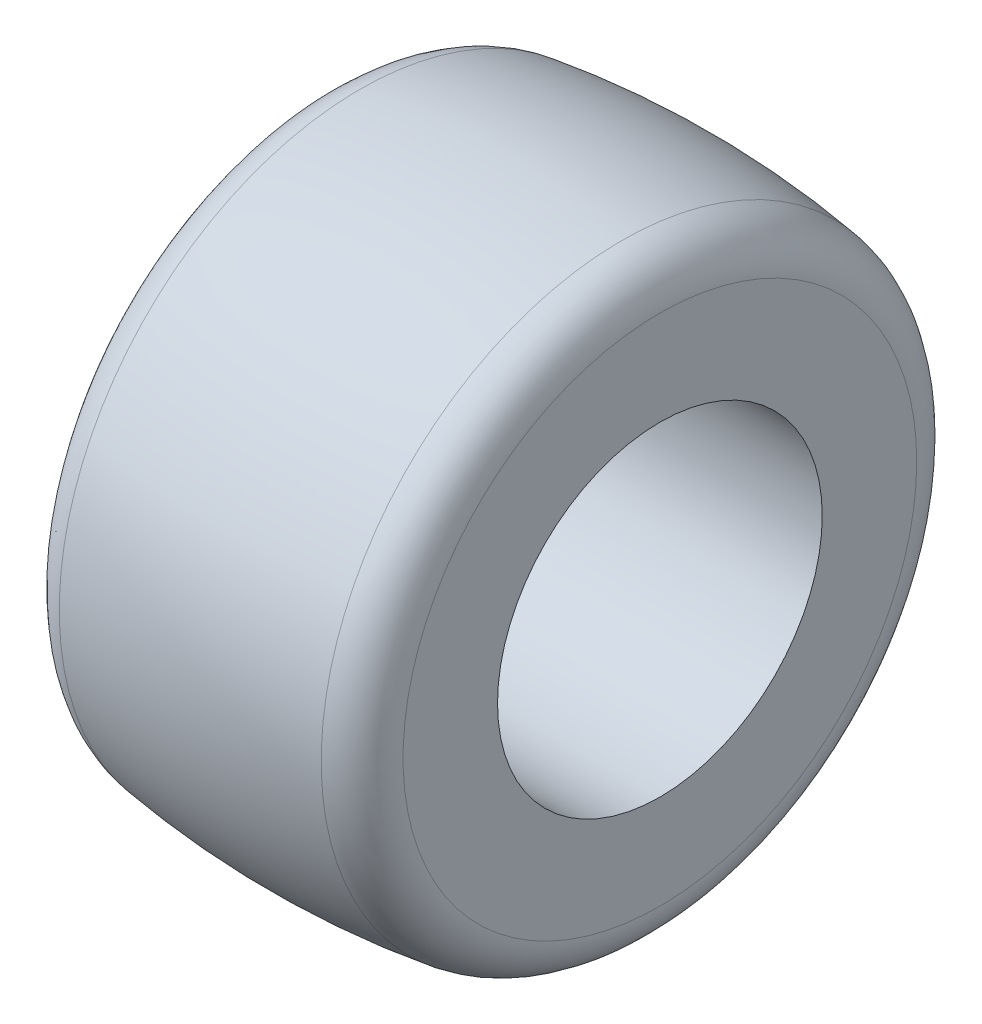
from build123d import *

# Parameters (mm, degrees)
SKETCH2_R          = 11
CUT_EXTRUDE1_DEPTH = 38.502133385


with BuildPart() as part:
    # Sketch1 → Revolve1 (revolve)
    with BuildSketch(Plane.XY, mode=Mode.PRIVATE) as revolve1_sk:
        with BuildLine():
            Line((0, 0), (0, 17.401543363))
            ThreePointArc((0, 17.401543363), (0.734116466, 19.367699972), (2.577181208, 20.371597953))
            ThreePointArc((2.577181208, 20.371597953), (11.45, 21), (20.322818792, 20.371597953))
            ThreePointArc((20.322818792, 20.371597953), (22.165883534, 19.367699972), (22.9, 17.401543363))
            Line((22.9, 17.401543363), (22.9, 0))
            Line((22.9, 0), (0, 0))
        make_face()
    revolve(revolve1_sk.sketch.rotate(Axis((22.9, 0, 0), (-1, 0, 0)), 90), axis=Axis((22.9, 0, 0), (-1, 0, 0)))

    # Sketch2 → Cut-Extrude1 (cut, through all)
    with BuildSketch(Plane(origin=(22.9, 0, 0), x_dir=(0, 0, -1), z_dir=(1, 0, 0))):
        Circle(SKETCH2_R)
    extrude(amount=-CUT_EXTRUDE1_DEPTH, mode=Mode.SUBTRACT)


solid = part.part
